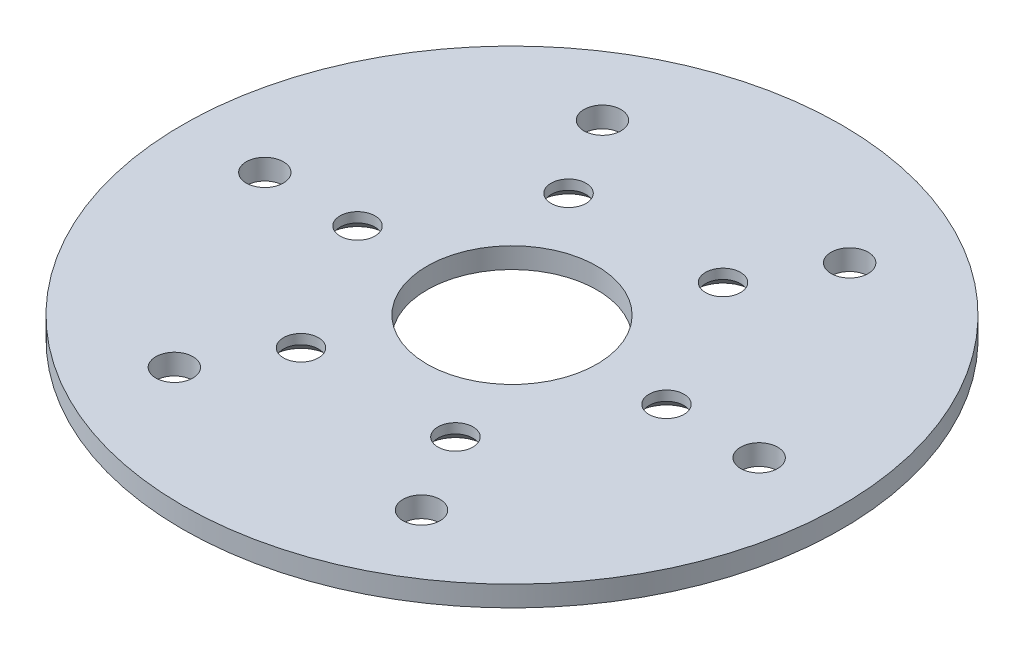
from build123d import *

# Parameters (mm, degrees)
SKETCH1_R                                    = 32
SKETCH1_R_2                                  = 8.25
BOSS_EXTRUDE1_DEPTH                          = 2
CSK_FOR_M3_HEX_SOCKET_COUNTERSUNK_HE_2_COUNT = 2
CSK_FOR_M3_HEX_SOCKET_COUNTERSUNK_HE_2_PITCH = 15
CSK_FOR_M3_HEX_SOCKET_COUNTERSUNK_HE_3_COUNT = 2
CSK_FOR_M3_HEX_SOCKET_COUNTERSUNK_HE_3_PITCH = 25.980762114
CSK_FOR_M3_HEX_SOCKET_COUNTERSUNK_HE_4_COUNT = 2
CSK_FOR_M3_HEX_SOCKET_COUNTERSUNK_HE_4_PITCH = 30
CSK_FOR_M3_HEX_SOCKET_COUNTERSUNK_HE_5_COUNT = 2
CSK_FOR_M3_HEX_SOCKET_COUNTERSUNK_HE_5_PITCH = 25.980762114
CSK_FOR_M3_HEX_SOCKET_COUNTERSUNK_HE_6_COUNT = 2
CSK_FOR_M3_HEX_SOCKET_COUNTERSUNK_HE_6_PITCH = 15
M3_CLEARANCE_HOLE1_D                         = 3.6


with BuildPart() as part:
    # Sketch1 → Boss-Extrude1 (new body)
    with BuildSketch(Plane(origin=(0, 0, 0), x_dir=(1, 0, 0), z_dir=(0, 1, 0))):
        with Locations(Location((0, 0, 0), (0, 0, 270))):
            Circle(SKETCH1_R)
        with Locations(Location((0, 0, 0), (0, 0, 270))):
            Circle(SKETCH1_R_2, mode=Mode.SUBTRACT)
    extrude(amount=BOSS_EXTRUDE1_DEPTH)

    # Sketch4 → CSK for M3 Hex Socket Countersunk Head Screw1 (revolve, cut)
    with BuildSketch(Plane(origin=(-7.5, 0, -12.990381057), x_dir=(0, 0, -1), z_dir=(1, 0, 0))):
        Polygon((0, 0), (0, 2), (1.7, 2), (1.7, 1.05), (2.75, 0), align=None)
    csk_for_m3_hex_socket_countersunk_head_s = revolve(axis=Axis((-7.5, -6.35, -12.990381057), (0, 1, 0)), mode=Mode.SUBTRACT)

    # CSK for M3 Hex Socket Countersunk He 2: CSK for M3 Hex Socket Countersunk Head Screw1 ×2
    with Locations(*[(i * CSK_FOR_M3_HEX_SOCKET_COUNTERSUNK_HE_2_PITCH, 0, 0) for i in range(1, CSK_FOR_M3_HEX_SOCKET_COUNTERSUNK_HE_2_COUNT)]):
        add(csk_for_m3_hex_socket_countersunk_head_s, mode=Mode.SUBTRACT)

    # CSK for M3 Hex Socket Countersunk He 3: CSK for M3 Hex Socket Countersunk Head Screw1 ×2
    with Locations(*[Vector(0.8660254037844752, 0, 0.49999999999993666) * (i * CSK_FOR_M3_HEX_SOCKET_COUNTERSUNK_HE_3_PITCH) for i in range(1, CSK_FOR_M3_HEX_SOCKET_COUNTERSUNK_HE_3_COUNT)]):
        add(csk_for_m3_hex_socket_countersunk_head_s, mode=Mode.SUBTRACT)

    # CSK for M3 Hex Socket Countersunk He 4: CSK for M3 Hex Socket Countersunk Head Screw1 ×2
    with Locations(*[Vector(0.5000000000000633, 0, 0.8660254037844022) * (i * CSK_FOR_M3_HEX_SOCKET_COUNTERSUNK_HE_4_PITCH) for i in range(1, CSK_FOR_M3_HEX_SOCKET_COUNTERSUNK_HE_4_COUNT)]):
        add(csk_for_m3_hex_socket_countersunk_head_s, mode=Mode.SUBTRACT)

    # CSK for M3 Hex Socket Countersunk He 5: CSK for M3 Hex Socket Countersunk Head Screw1 ×2
    with Locations(*[(0, 0, i * CSK_FOR_M3_HEX_SOCKET_COUNTERSUNK_HE_5_PITCH) for i in range(1, CSK_FOR_M3_HEX_SOCKET_COUNTERSUNK_HE_5_COUNT)]):
        add(csk_for_m3_hex_socket_countersunk_head_s, mode=Mode.SUBTRACT)

    # CSK for M3 Hex Socket Countersunk He 6: CSK for M3 Hex Socket Countersunk Head Screw1 ×2
    with Locations(*[Vector(-0.499999999999937, 0, 0.8660254037844751) * (i * CSK_FOR_M3_HEX_SOCKET_COUNTERSUNK_HE_6_PITCH) for i in range(1, CSK_FOR_M3_HEX_SOCKET_COUNTERSUNK_HE_6_COUNT)]):
        add(csk_for_m3_hex_socket_countersunk_head_s, mode=Mode.SUBTRACT)

    # M3 Clearance Hole1 (through all)
    with Locations(Plane(origin=(0, 0, 0), x_dir=(-1, 0, 0), z_dir=(0, -1, 0))):
        with Locations((-12, -20.784609691), (-24, 0), (-12, 20.784609691), (12, 20.784609691), (24, 0), (12, -20.784609691)):
            Hole(M3_CLEARANCE_HOLE1_D / 2)


solid = part.part
